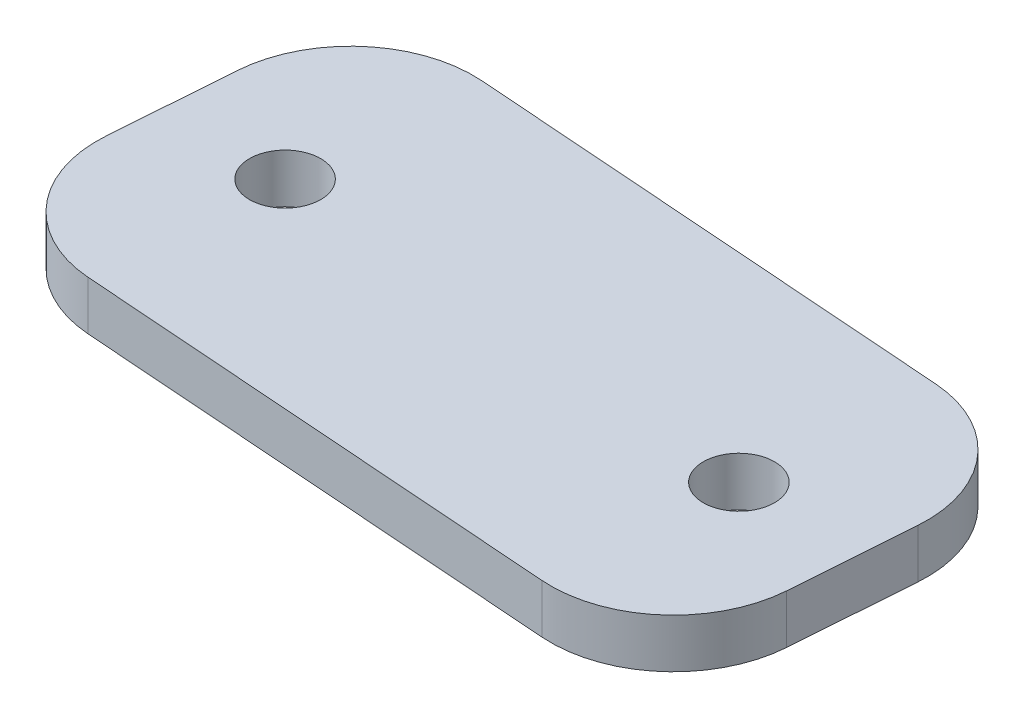
from build123d import *

# Parameters (mm, degrees)
SKETCH_1_R      = 1.45
EXTRUDE_1_DEPTH = 2
FILLET_1_R      = 5


with BuildPart() as part:
    # 草图1 → 凸台-拉伸1 (new body)
    with BuildSketch(Plane(origin=(0, 0, 0), x_dir=(1, 0, 0), z_dir=(0, 1, 0))):
        Polygon((651.168451136, -32.371101997), (650.079202112, -47.331500941), (680, -49.50999899), (681.089249024, -34.549600046), align=None)
        with Locations(Location((655.610626272, -40.214384477, 0), (0, 0, 270))):
            Circle(SKETCH_1_R, mode=Mode.SUBTRACT)
        with Locations(Location((675.557824864, -41.66671651, 0), (0, 0, 270))):
            Circle(SKETCH_1_R, mode=Mode.SUBTRACT)
    extrude(amount=EXTRUDE_1_DEPTH)

    # 圆角1
    fillet_1_edges = [part.edges().sort_by_distance(p)[0] for p in [
        (680, 1, 49.50999899),
        (650.079202112, 1, 47.331500941),
        (651.168451136, 1, 32.371101997),
        (681.089249024, 1, 34.549600046),
    ]]
    fillet(fillet_1_edges, radius=FILLET_1_R)


solid = part.part
